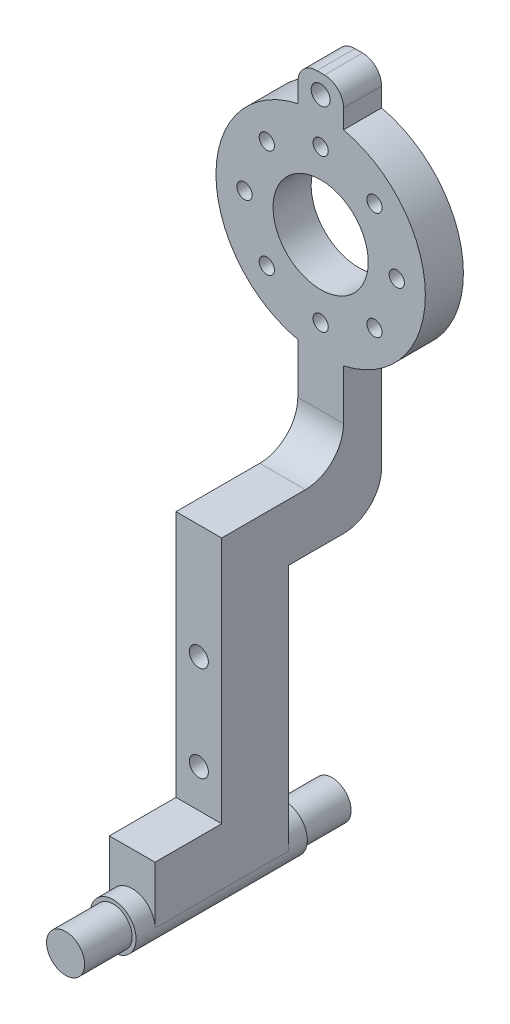
from build123d import *

# Parameters (mm, degrees)
SKETCH_1_R               = 5
EXTRUDE_1_DEPTH          = 12.5
SKETCH_2_R               = 6
EXTRUDE_2_DEPTH          = 22.5
SKETCH_3_R               = 5
EXTRUDE_3_DEPTH          = 12.5
SKETCH_4_W               = 12
SKETCH_4_H               = 35
EXTRUDE_4_DEPTH          = 80
EXTRUDE_5_DEPTH          = 12
EXTRUDE_6_DEPTH          = 10
SKETCH_7_R               = 9.5
CUT_EXTRUDE_1_DEPTH      = 2
SKETCH_8_R               = 6
CUT_EXTRUDE_2_DEPTH      = 166.329973084
EXTRUDE_START            = -10
EXTRUDE_7_DEPTH          = 10
SKETCH_10_R              = 2.5
CUT_EXTRUDE_3_DEPTH      = 10
FILLET_1_R               = 5
FILLET_2_R               = 5
SKETCH_11_R              = 2.5
CUT_EXTRUDE_4_DEPTH      = 10
EXTRUDE_8_DEPTH          = 10
SKETCH_13_R              = 12.5
SKETCH_13_R_2            = 2
CUT_EXTRUDE_5_DEPTH      = 10
PATTERN_CIRCULAR_1_COUNT = 8
SKETCH_14_R              = 2.5
EXTRUDE_9_DEPTH          = 10
SKETCH_15_R              = 2.5
CUT_EXTRUDE_6_DEPTH      = 35
CUT_EXTRUDE_7_DEPTH      = 175.719754648


with BuildPart() as part:
    # 草图1 → 凸台-拉伸1 (new body)
    with BuildSketch(Plane.XY):
        Circle(SKETCH_1_R)
    extrude(amount=EXTRUDE_1_DEPTH)

    # 草图2 → 凸台-拉伸2 (add)
    with BuildSketch(Plane.XY.offset(12.5)):
        with Locations(Location((0, 0, 0), (0, 0, 180))):
            Circle(SKETCH_2_R)
    extrude_2 = extrude(amount=EXTRUDE_2_DEPTH)

    # 镜向2: 凸台-拉伸2 across plane
    add(extrude_2.mirror(Plane.XY.offset(35)))

    # 草图3 → 凸台-拉伸3 (add)
    with BuildSketch(Plane.XY.offset(57.5)):
        Circle(SKETCH_3_R)
    extrude(amount=EXTRUDE_3_DEPTH)

    # 草图4 → 凸台-拉伸4 (add)
    with BuildSketch(Plane(origin=(0, 0, 0), x_dir=(1, 0, 0), z_dir=(0, 1, 0))):
        with Locations((0, -35)):
            Rectangle(SKETCH_4_W, SKETCH_4_H)
    extrude(amount=EXTRUDE_4_DEPTH)

    # 草图5 → 凸台-拉伸5 (add)
    with BuildSketch(Plane.ZY.offset(6)):
        with BuildLine():
            Line((17.5, 65), (17.5, 80))
            Line((17.5, 80), (13, 80))
            ThreePointArc((13, 80), (5.928932188, 82.928932188), (3, 90))
            Line((3, 90), (3, 130))
            Line((3, 130), (-7, 130))
            Line((-7, 130), (-7, 75))
            ThreePointArc((-7, 75), (-4.071067812, 67.928932188), (3, 65))
            Line((3, 65), (17.5, 65))
        make_face()
        with BuildLine():
            Line((59, 80), (52.5, 80))
            Line((52.5, 80), (52.5, 65))
            Line((52.5, 65), (69, 65))
            ThreePointArc((69, 65), (76.071067812, 67.928932188), (79, 75))
            Line((79, 75), (79, 130))
            Line((79, 130), (69, 130))
            Line((69, 130), (69, 90))
            ThreePointArc((69, 90), (66.071067812, 82.928932188), (59, 80))
        make_face()
    extrude(amount=-EXTRUDE_5_DEPTH)

    # 草图6 → 凸台-拉伸6 (add)
    with BuildSketch(Plane(origin=(0, 0, 69), x_dir=(-1, 0, 0), z_dir=(0, 0, -1))):
        with BuildLine():
            Line((6, 116.252272915), (6, 130))
            Line((6, 130), (-6, 130))
            Line((-6, 130), (-6, 116.252272915))
            ThreePointArc((-6, 116.252272915), (0, 115), (6, 116.252272915))
        make_face()
        with BuildLine():
            Line((-6, 130), (6, 130))
            Line((6, 130), (6, 116.252272915))
            ThreePointArc((6, 116.252272915), (12.549900398, 121.784161637), (15, 130))
            ThreePointArc((15, 130), (-8.215838363, 142.549900398), (-6, 116.252272915))
            Line((-6, 116.252272915), (-6, 130))
        make_face()
    extrude(amount=-EXTRUDE_6_DEPTH)

    # 草图7 → 切除-拉伸1 (cut)
    with BuildSketch(Plane(origin=(0, 0, 69), x_dir=(-1, 0, 0), z_dir=(0, 0, -1))):
        with Locations((0, 130)):
            Circle(SKETCH_7_R)
    extrude(amount=-CUT_EXTRUDE_1_DEPTH, mode=Mode.SUBTRACT)

    # 草图8 → 切除-拉伸2 (cut, through all)
    with BuildSketch(Plane(origin=(0, 0, 71), x_dir=(-1, 0, 0), z_dir=(0, 0, -1))):
        with Locations((0, 130)):
            Circle(SKETCH_8_R)
    extrude(amount=-CUT_EXTRUDE_2_DEPTH, mode=Mode.SUBTRACT)

    # 草图9 → 凸台-拉伸7 (add)
    with BuildSketch(Plane.XY.offset(79).offset(EXTRUDE_START)):
        with BuildLine():
            Line((-15, 155), (-15, 130))
            ThreePointArc((-15, 130), (0, 145), (15, 130))
            Line((15, 130), (15, 155))
            Line((15, 155), (-15, 155))
        make_face()
    extrude(amount=EXTRUDE_7_DEPTH)

    # 草图10 → 切除-拉伸3 (cut)
    with BuildSketch(Plane.XY.offset(79)):
        with Locations((10, 150)):
            Circle(SKETCH_10_R)
    extrude(amount=-CUT_EXTRUDE_3_DEPTH, mode=Mode.SUBTRACT)

    # 圆角1
    fillet_1_edges = [part.edges().sort_by_distance(p)[0] for p in [
        (15, 155, 74),
    ]]
    fillet(fillet_1_edges, radius=FILLET_1_R)

    # 圆角2
    fillet_2_edges = [part.edges().sort_by_distance(p)[0] for p in [
        (-15, 155, 74),
    ]]
    fillet(fillet_2_edges, radius=FILLET_2_R)

    # 草图11 → 切除-拉伸4 (cut)
    with BuildSketch(Plane.XY.offset(79)):
        with Locations((-10, 150)):
            Circle(SKETCH_11_R)
    extrude(amount=-CUT_EXTRUDE_4_DEPTH, mode=Mode.SUBTRACT)

    # 草图12 → 凸台-拉伸8 (add)
    with BuildSketch(Plane.XY.offset(3)):
        with BuildLine():
            ThreePointArc((-6, 103.162526199), (0, 102.5), (6, 103.162526199))
            Line((6, 103.162526199), (6, 130))
            Line((6, 130), (-6, 130))
            Line((-6, 130), (-6, 103.162526199))
        make_face()
        with BuildLine():
            Line((6, 130), (6, 103.162526199))
            ThreePointArc((6, 103.162526199), (21.462176031, 112.806251136), (27.5, 130))
            ThreePointArc((27.5, 130), (-17.193748864, 151.462176031), (-6, 103.162526199))
            Line((-6, 103.162526199), (-6, 130))
            Line((-6, 130), (6, 130))
        make_face()
    extrude(amount=-EXTRUDE_8_DEPTH)

    # 草图13 → 切除-拉伸5 (cut)
    with BuildSketch(Plane(origin=(0, 0, -7), x_dir=(-1, 0, 0), z_dir=(0, 0, -1))):
        with Locations(Location((0, 130, 0), (0, 0, 90))):
            Circle(SKETCH_13_R)
        with Locations(Location((0, 150, 0), (0, 0, 90))):
            Circle(SKETCH_13_R_2)
    cut_extrude_5 = extrude(amount=-CUT_EXTRUDE_5_DEPTH, mode=Mode.SUBTRACT)

    # 阵列(圆周)1: 切除-拉伸5 ×8 about axis
    pattern_circular_1_axis = Axis((0, 130, 0), (0, 0, 1))
    for i in range(1, PATTERN_CIRCULAR_1_COUNT):
        add(cut_extrude_5.rotate(pattern_circular_1_axis, i * 360 / PATTERN_CIRCULAR_1_COUNT), mode=Mode.SUBTRACT)

    # 草图14 → 凸台-拉伸9 (add)
    with BuildSketch(Plane(origin=(0, 0, -7), x_dir=(-1, 0, 0), z_dir=(0, 0, -1)).offset(EXTRUDE_START)):
        with BuildLine():
            Line((-6, 161.837473801), (-6, 156.837473801))
            ThreePointArc((-6, 156.837473801), (0, 157.5), (6, 156.837473801))
            Line((6, 156.837473801), (6, 161.837473801))
            ThreePointArc((6, 161.837473801), (4.535533906, 165.373007707), (1, 166.837473801))
            Line((1, 166.837473801), (-1, 166.837473801))
            ThreePointArc((-1, 166.837473801), (-4.535533906, 165.373007707), (-6, 161.837473801))
        make_face()
        with Locations(Location((0, 161.837473801, 0), (0, 0, 90))):
            Circle(SKETCH_14_R, mode=Mode.SUBTRACT)
    extrude(amount=EXTRUDE_9_DEPTH)

    # 草图15 → 切除-拉伸6 (cut)
    with BuildSketch(Plane(origin=(0, 0, 17.5), x_dir=(-1, 0, 0), z_dir=(0, 0, -1))):
        with Locations((0, 25)):
            Circle(SKETCH_15_R)
        with Locations((0, 50)):
            Circle(SKETCH_15_R)
    extrude(amount=-CUT_EXTRUDE_6_DEPTH, mode=Mode.SUBTRACT)

    # 草图16 → 切除-拉伸7 (cut, through all)
    with BuildSketch(Plane.XY.offset(35)):
        Polygon((-6, 97.653254631), (-6, 65), (-6, 15), (6, 15), (6, 65), (6, 97.653254631), align=None)
    extrude(amount=CUT_EXTRUDE_7_DEPTH, mode=Mode.SUBTRACT)


with BuildPart() as body_2:
    # of the pieces the cut leaves, the one that is kept (cut_extrude_7_keep)
    add(part.part.solids().sort_by_distance((-6, 0, 17.5))[0])


solid = body_2.part
